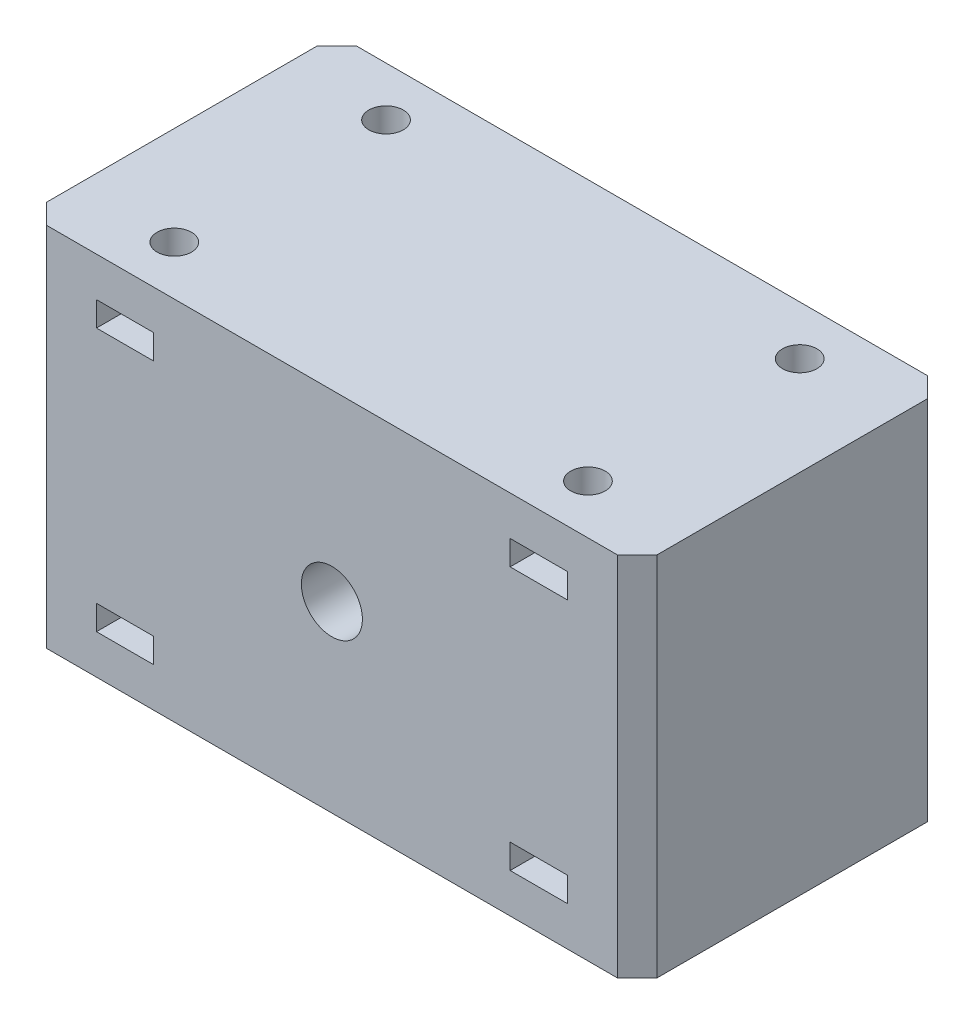
from build123d import *

# Parameters (mm, degrees)
BOSS_EXTRUDE1_DEPTH      = 18.6
BOSS_EXTRUDE1_DEPTH_BACK = 18.6
SKETCH2_W                = 62
SKETCH2_H                = 31.5
CUT_EXTRUDE1_DEPTH       = 40.433773596
CUT_EXTRUDE1_DEPTH_BACK  = 40.433773596
SKETCH3_R                = 3.1
SKETCH5_R                = 1.75
CUT_EXTRUDE2_DEPTH       = 10
CUT_EXTRUDE3_START       = -10
SKETCH6_R                = 1.75
CUT_EXTRUDE3_DEPTH       = 10
CUT_EXTRUDE4_START       = -4
SKETCH7_W                = 5.8
SKETCH7_H                = 9
CUT_EXTRUDE4_DEPTH       = 2.5
CUT_EXTRUDE5_START       = -4
SKETCH8_W                = 5.8
SKETCH8_H                = 9
CUT_EXTRUDE5_DEPTH       = 2.5
CHAMFER1_SIZE            = 2


with BuildPart() as part:
    # Sketch2 → Boss-Extrude1 (new, two sides: drawn at the far end of the back side and taken through both)
    with BuildSketch(Plane(origin=(0, 0, 0), x_dir=(1, 0, 0), z_dir=(0, 1, 0)).offset(-BOSS_EXTRUDE1_DEPTH_BACK)):
        Rectangle(SKETCH2_W, SKETCH2_H)
    extrude(amount=BOSS_EXTRUDE1_DEPTH + BOSS_EXTRUDE1_DEPTH_BACK)

    # Sketch3 → Cut-Extrude1 (cut, two sides: drawn at the far end of the back side and taken through both)
    with BuildSketch(Plane.XY.offset(-CUT_EXTRUDE1_DEPTH_BACK)):
        Circle(SKETCH3_R)
    extrude(amount=CUT_EXTRUDE1_DEPTH + CUT_EXTRUDE1_DEPTH_BACK, mode=Mode.SUBTRACT)

    # Sketch5 → Cut-Extrude2 (cut)
    with BuildSketch(Plane(origin=(0, 18.6, 0), x_dir=(1, 0, 0), z_dir=(0, 1, 0))):
        with Locations(Location((-21, -10.75, 0), (0, 0, 270))):
            Circle(SKETCH5_R)
        with Locations(Location((21, -10.75, 0), (0, 0, 270))):
            Circle(SKETCH5_R)
        with Locations(Location((21, 10.75, 0), (0, 0, 270))):
            Circle(SKETCH5_R)
        with Locations(Location((-21, 10.75, 0), (0, 0, 270))):
            Circle(SKETCH5_R)
    extrude(amount=-CUT_EXTRUDE2_DEPTH, mode=Mode.SUBTRACT)

    # Sketch6 → Cut-Extrude3 (cut)
    with BuildSketch(Plane.XZ.offset(18.6).offset(CUT_EXTRUDE3_START)):
        with Locations(Location((-21, 10.75, 0), (0, 0, 90))):
            Circle(SKETCH6_R)
        with Locations(Location((21, 10.75, 0), (0, 0, 90))):
            Circle(SKETCH6_R)
        with Locations(Location((21, -10.75, 0), (0, 0, 90))):
            Circle(SKETCH6_R)
        with Locations(Location((-21, -10.75, 0), (0, 0, 90))):
            Circle(SKETCH6_R)
    extrude(amount=CUT_EXTRUDE3_DEPTH, mode=Mode.SUBTRACT)

    # Sketch7 → Cut-Extrude4 (cut)
    with BuildSketch(Plane(origin=(0, 18.6, 0), x_dir=(1, 0, 0), z_dir=(0, 1, 0)).offset(CUT_EXTRUDE4_START)):
        with Locations((-21, 11.25)):
            Rectangle(SKETCH7_W, SKETCH7_H)
        with Locations((21, 11.25)):
            Rectangle(SKETCH7_W, SKETCH7_H)
        with Locations((21, -11.25)):
            Rectangle(SKETCH7_W, SKETCH7_H)
        with Locations((-21, -11.25)):
            Rectangle(SKETCH7_W, SKETCH7_H)
    extrude(amount=-CUT_EXTRUDE4_DEPTH, mode=Mode.SUBTRACT)

    # Sketch8 → Cut-Extrude5 (cut)
    with BuildSketch(Plane.XZ.offset(18.6).offset(CUT_EXTRUDE5_START)):
        with Locations((-21, -11.25)):
            Rectangle(SKETCH8_W, SKETCH8_H)
        with Locations((-21, 11.25)):
            Rectangle(SKETCH8_W, SKETCH8_H)
        with Locations((21, 11.25)):
            Rectangle(SKETCH8_W, SKETCH8_H)
        with Locations((21, -11.25)):
            Rectangle(SKETCH8_W, SKETCH8_H)
    extrude(amount=-CUT_EXTRUDE5_DEPTH, mode=Mode.SUBTRACT)

    # Chamfer1
    chamfer1_edges = [part.edges().sort_by_distance(p)[0] for p in [
        (31, 0, 15.75),
        (31, 0, -15.75),
        (-31, 0, -15.75),
        (-31, 0, 15.75),
    ]]
    chamfer(chamfer1_edges, length=CHAMFER1_SIZE)


solid = part.part
